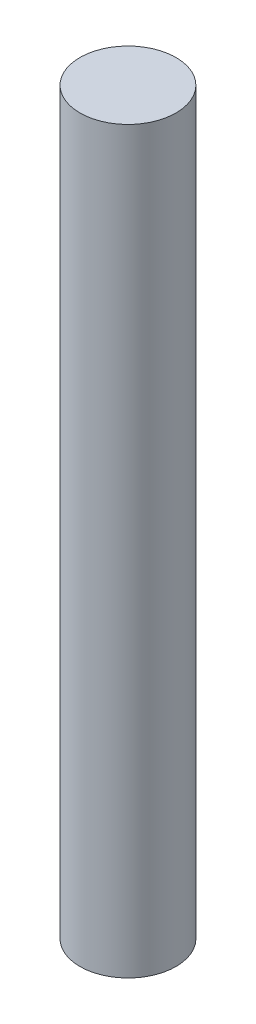
from build123d import *

# Parameters (mm, degrees)
SKETCH1_R           = 3.25
BOSS_EXTRUDE1_DEPTH = 50


with BuildPart() as part:
    # Sketch1 → Boss-Extrude1 (new body)
    with BuildSketch(Plane(origin=(0, 0, 0), x_dir=(1, 0, 0), z_dir=(0, 1, 0))):
        with Locations(Location((0, 0, 0), (0, 0, 270))):
            Circle(SKETCH1_R)
    extrude(amount=BOSS_EXTRUDE1_DEPTH)


solid = part.part
